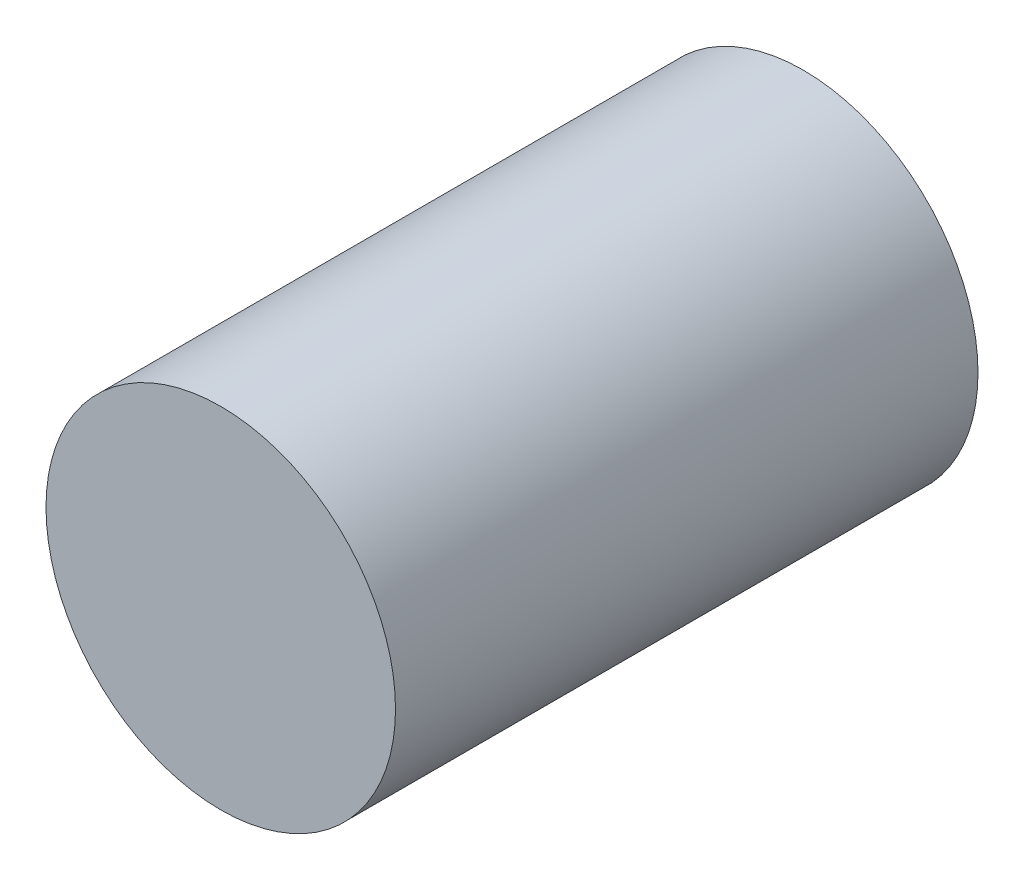
from build123d import *

# Parameters (mm, degrees)
SKETCH1_R           = 0.75
BOSS_EXTRUDE1_DEPTH = 3
BOSS_EXTRUDE2_START = 1
SKETCH2_R           = 0.75
BOSS_EXTRUDE2_DEPTH = 1
BOSS_EXTRUDE3_START = 1
SKETCH3_R           = 0.75
BOSS_EXTRUDE3_DEPTH = 1
SKETCH4_R           = 0.75
CUT_EXTRUDE1_DEPTH  = 2.5


with BuildPart() as part:
    # Sketch1 → Boss-Extrude1 (new body)
    with BuildSketch(Plane.XY):
        Circle(SKETCH1_R)
    extrude(amount=BOSS_EXTRUDE1_DEPTH)

    # Sketch2 → Boss-Extrude2 (add)
    with BuildSketch(Plane(origin=(0, 0, 0), x_dir=(-1, 0, 0), z_dir=(0, 0, -1)).offset(BOSS_EXTRUDE2_START)):
        Circle(SKETCH2_R)
    extrude(amount=-BOSS_EXTRUDE2_DEPTH)

    # Sketch3 → Boss-Extrude3 (add)
    with BuildSketch(Plane(origin=(0, 0, -1), x_dir=(-1, 0, 0), z_dir=(0, 0, -1)).offset(BOSS_EXTRUDE3_START)):
        Circle(SKETCH3_R)
    extrude(amount=-BOSS_EXTRUDE3_DEPTH)

    # Sketch4 → Cut-Extrude1 (cut)
    with BuildSketch(Plane(origin=(0, 0, -2), x_dir=(-1, 0, 0), z_dir=(0, 0, -1))):
        Circle(SKETCH4_R)
    extrude(amount=-CUT_EXTRUDE1_DEPTH, mode=Mode.SUBTRACT)


solid = part.part
